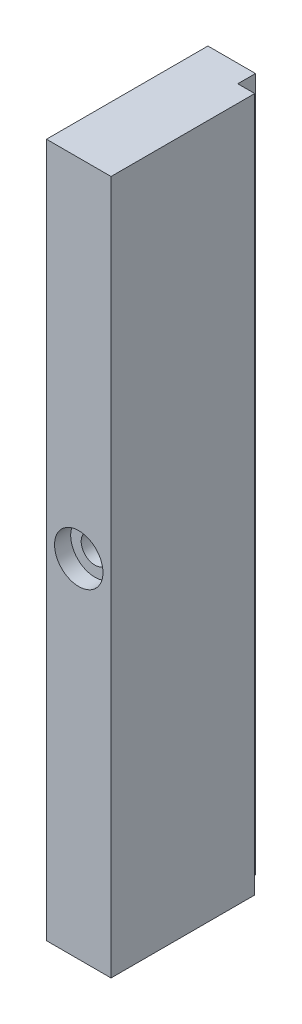
from build123d import *

# Parameters (mm, degrees)
MAIN_PROFILE_SKETCH_W     = 8
MAIN_PROFILE_SKETCH_H     = 86
MAIN_PROFILE_SKETCH_R     = 3
MAIN_EXTRUSION_DEPTH      = 2
DETAIL_PROFILE_2_SKETCH_W = 8
DETAIL_PROFILE_2_SKETCH_H = 86
DETAIL_PROFILE_2_SKETCH_R = 1.7
DETAIL_EXTRUSION_2_DEPTH  = 15.8
DETAIL_PROFILE_3_SKETCH_W = 5.9
DETAIL_PROFILE_3_SKETCH_H = 86
DETAIL_PROFILE_3_SKETCH_R = 1.7
DETAIL_EXTRUSION_3_DEPTH  = 2.2


with BuildPart() as part:
    # Main Profile Sketch → Main Extrusion (new body)
    with BuildSketch(Plane.XY.offset(140)):
        with Locations((136.5, 0)):
            Rectangle(MAIN_PROFILE_SKETCH_W, MAIN_PROFILE_SKETCH_H)
        with Locations((136.5, 0)):
            Circle(MAIN_PROFILE_SKETCH_R, mode=Mode.SUBTRACT)
    extrude(amount=-MAIN_EXTRUSION_DEPTH)

    # Detail Profile 2 Sketch → Detail Extrusion 2 (add)
    with BuildSketch(Plane.XY.offset(138)):
        with Locations((136.5, 0)):
            Rectangle(DETAIL_PROFILE_2_SKETCH_W, DETAIL_PROFILE_2_SKETCH_H)
        with Locations((136.5, 0)):
            Circle(DETAIL_PROFILE_2_SKETCH_R, mode=Mode.SUBTRACT)
    extrude(amount=-DETAIL_EXTRUSION_2_DEPTH)

    # Detail Profile 3 Sketch → Detail Extrusion 3 (add)
    with BuildSketch(Plane.XY.offset(122.2)):
        with Locations((135.45, 0)):
            Rectangle(DETAIL_PROFILE_3_SKETCH_W, DETAIL_PROFILE_3_SKETCH_H)
        with Locations((136.5, 0)):
            Circle(DETAIL_PROFILE_3_SKETCH_R, mode=Mode.SUBTRACT)
    extrude(amount=-DETAIL_EXTRUSION_3_DEPTH)


solid = part.part
